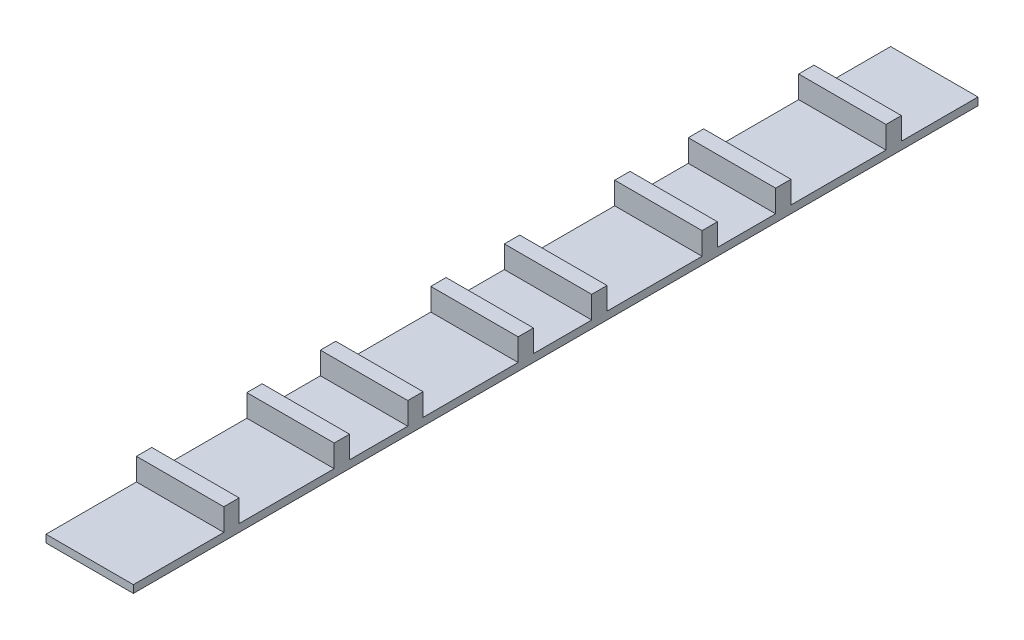
from build123d import *

# Parameters (mm, degrees)
SKETCH2_W           = 5.7
SKETCH2_H           = 0.5
BOSS_EXTRUDE1_DEPTH = 55.1
SKETCH3_W           = 5.7
SKETCH3_H           = 1
BOSS_EXTRUDE2_DEPTH = 1.45
LPATTERN1_COUNT     = 4
LPATTERN1_PITCH     = 12


with BuildPart() as part:
    # Sketch2 → Boss-Extrude1 (new body)
    with BuildSketch(Plane.XY):
        with Locations((2.85, 0.25)):
            Rectangle(SKETCH2_W, SKETCH2_H)
    extrude(amount=BOSS_EXTRUDE1_DEPTH)

    # Sketch3 → Boss-Extrude2 (add)
    with BuildSketch(Plane(origin=(0, 0.5, 0), x_dir=(1, 0, 0), z_dir=(0, 1, 0))):
        with Locations((2.85, -5.5)):
            Rectangle(SKETCH3_W, SKETCH3_H)
        with Locations((2.85, -12.7)):
            Rectangle(SKETCH3_W, SKETCH3_H)
    boss_extrude2 = extrude(amount=BOSS_EXTRUDE2_DEPTH)

    # LPattern1: Boss-Extrude2 ×4
    with Locations(*[(0, 0, i * LPATTERN1_PITCH) for i in range(1, LPATTERN1_COUNT)]):
        add(boss_extrude2)


solid = part.part
